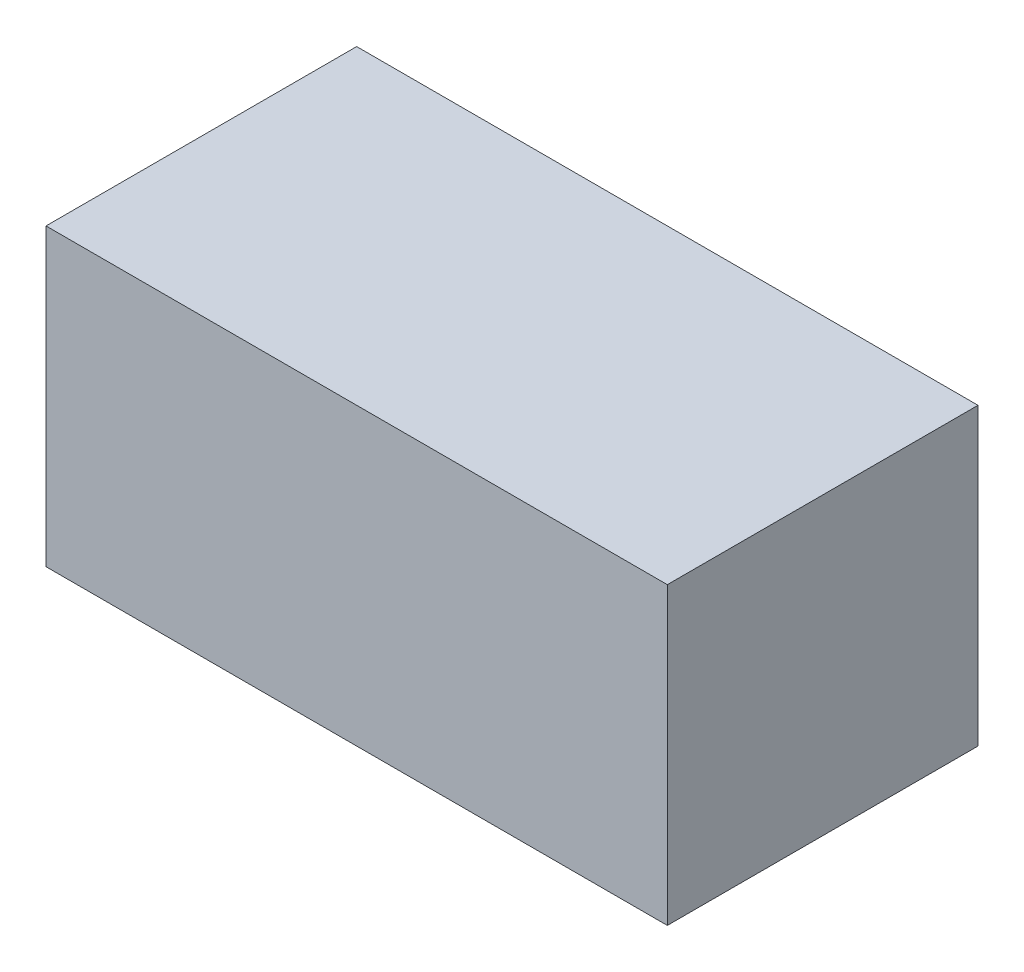
from build123d import *

# Parameters (mm, degrees)
SKETCH1_W           = 40
SKETCH1_H           = 20
BOSS_EXTRUDE1_DEPTH = 19


with BuildPart() as part:
    # Sketch1 → Boss-Extrude1 (new body)
    with BuildSketch(Plane(origin=(0, 0, 0), x_dir=(1, 0, 0), z_dir=(0, 1, 0))):
        with Locations((20, 10)):
            Rectangle(SKETCH1_W, SKETCH1_H)
    extrude(amount=-BOSS_EXTRUDE1_DEPTH)


solid = part.part
